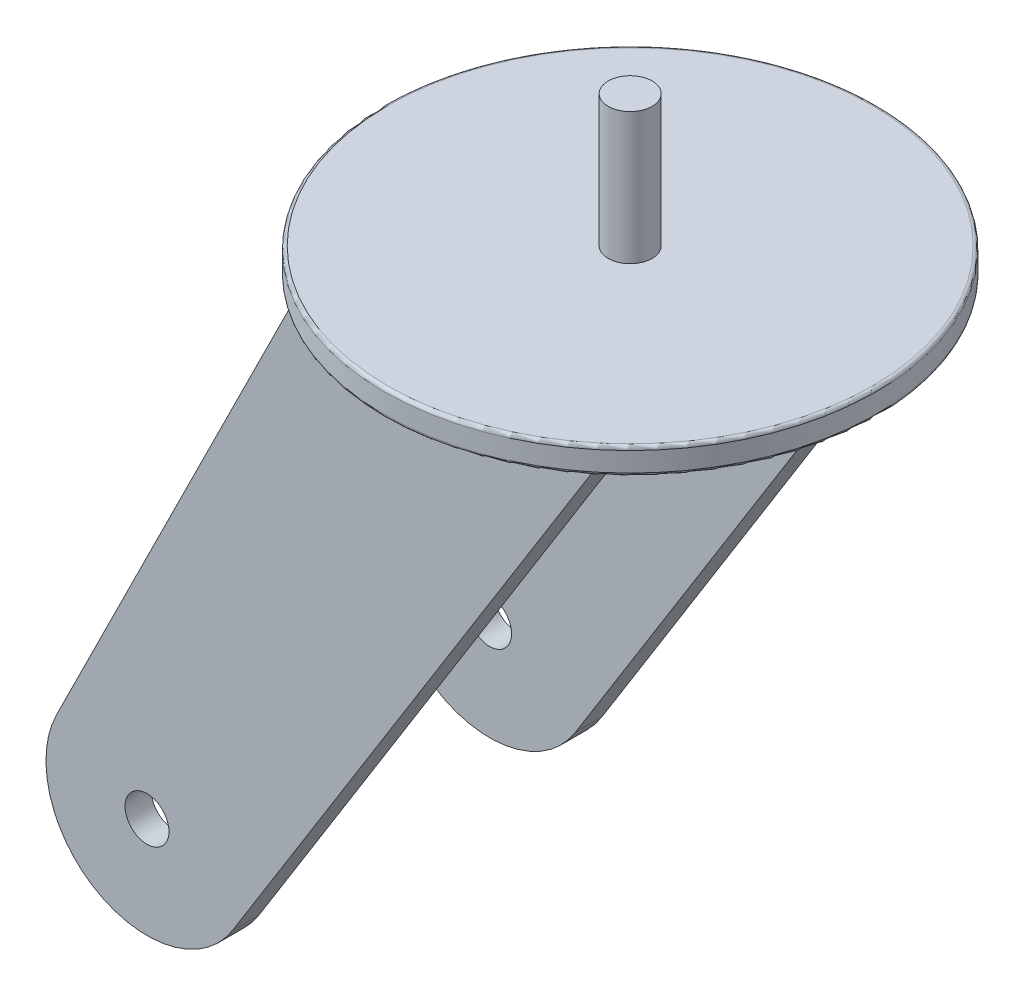
from build123d import *

# Parameters (mm, degrees)
SKETCH1_R           = 71.12
BOSS_EXTRUDE1_DEPTH = 7.62
FILLET1_R           = 0.9906
SKETCH3_R           = 6.35
BOSS_EXTRUDE2_DEPTH = 7.62
SKETCH5_R           = 6.35
BOSS_EXTRUDE3_DEPTH = 38.1


with BuildPart() as part:
    # Sketch1 → Boss-Extrude1 (new body)
    with BuildSketch(Plane(origin=(0, 0, 0), x_dir=(1, 0, 0), z_dir=(0, 1, 0))):
        with Locations(Location((0, 0, 0), (0, 0, 270))):
            Circle(SKETCH1_R)
    extrude(amount=BOSS_EXTRUDE1_DEPTH)

    # Fillet1
    fillet1_edges = [part.edges().sort_by_distance(p)[0] for p in [
        (0, 0, -71.12),
        (0, 7.62, -71.12),
    ]]
    fillet(fillet1_edges, radius=FILLET1_R)

    # Sketch3 → Boss-Extrude2 (add)
    with BuildSketch(Plane.XY.offset(45.72)):
        with BuildLine():
            Line((0, 0), (43.18, 0))
            Line((43.18, 0), (-61.579637217, -167.864725032))
            ThreePointArc((-61.579637217, -167.864725032), (-100.613254195, -177.896447691), (-112.513352174, -139.391300217))
            Line((-112.513352174, -139.391300217), (-43.18, 0))
            Line((-43.18, 0), (0, 0))
        make_face()
        with Locations((-86.36, -152.4)):
            Circle(SKETCH3_R, mode=Mode.SUBTRACT)
    boss_extrude2 = extrude(amount=BOSS_EXTRUDE2_DEPTH)

    # Mirror1: Boss-Extrude2 across plane
    add(boss_extrude2.mirror(Plane.XY))

    # Sketch5 → Boss-Extrude3 (add)
    with BuildSketch(Plane(origin=(0, 7.62, 0), x_dir=(1, 0, 0), z_dir=(0, 1, 0))):
        with Locations(Location((0, 0, 0), (0, 0, 90))):
            Circle(SKETCH5_R)
    extrude(amount=BOSS_EXTRUDE3_DEPTH)


solid = part.part
